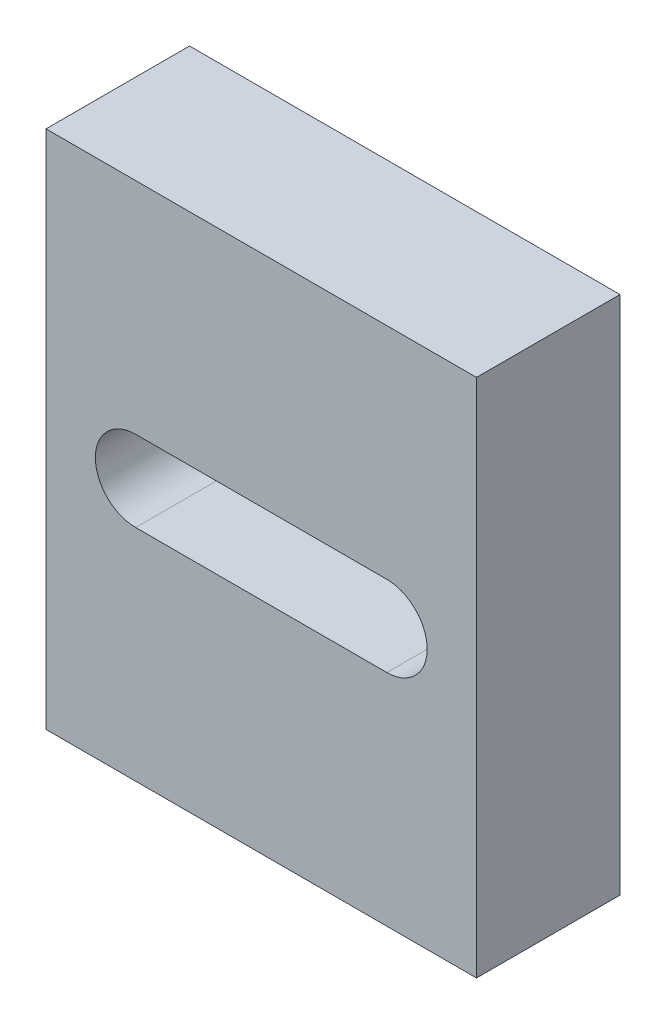
from build123d import *

# Parameters (mm, degrees)
SKETCH_1_W          = 48
SKETCH_1_H          = 58
EXTRUDE_1_DEPTH     = 16
CUT_EXTRUDE_1_DEPTH = 41.902322672


with BuildPart() as part:
    # 草图1 → 凸台-拉伸1 (new body)
    with BuildSketch(Plane.XY):
        Rectangle(SKETCH_1_W, SKETCH_1_H)
    extrude(amount=-EXTRUDE_1_DEPTH)

    # 草图2 → 切除-拉伸1 (cut, through all)
    with BuildSketch(Plane.XY):
        with BuildLine():
            Line((-14, 4.5), (14, 4.5))
            ThreePointArc((14, 4.5), (18.5, 0), (14, -4.5))
            Line((14, -4.5), (-14, -4.5))
            ThreePointArc((-14, -4.5), (-18.5, 0), (-14, 4.5))
        make_face()
    extrude(amount=-CUT_EXTRUDE_1_DEPTH, mode=Mode.SUBTRACT)


solid = part.part
